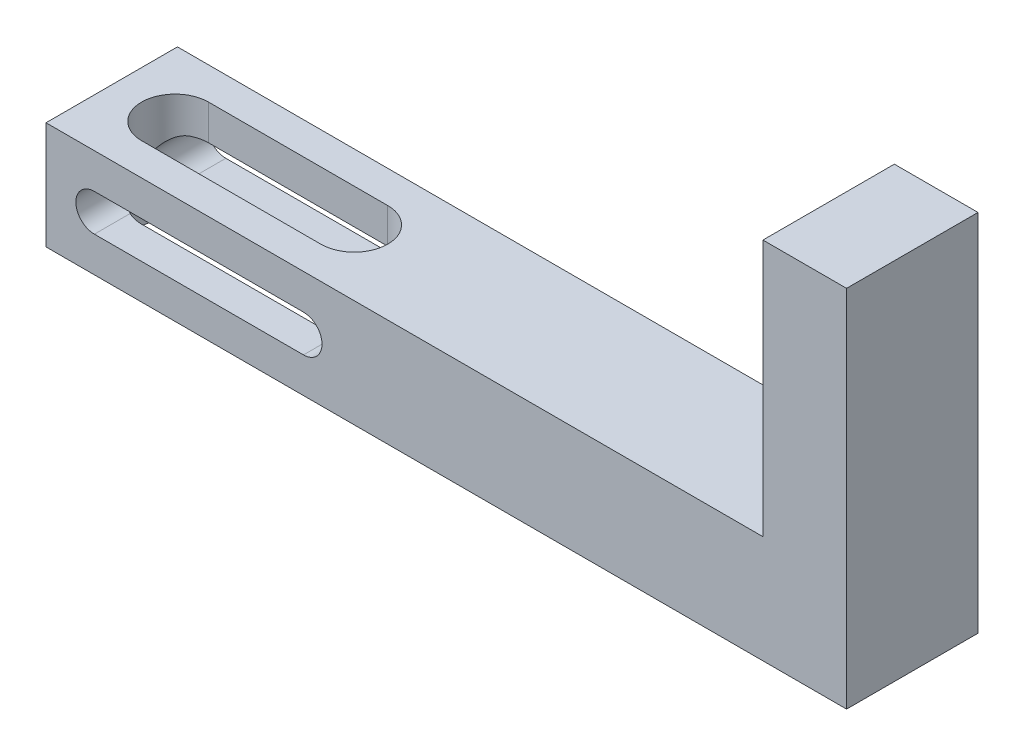
from build123d import *

# Parameters (mm, degrees)
BOSS_EXTRUDE1_DEPTH = 11
CUT_EXTRUDE1_DEPTH  = 75.432855649
CUT_EXTRUDE2_DEPTH  = 75.432855649


with BuildPart() as part:
    # Sketch1 → Boss-Extrude1 (new body)
    with BuildSketch(Plane.XY):
        Polygon((0, 0), (67, 0), (67, 30.5), (60, 30.5), (60, 9), (0, 9), align=None)
    extrude(amount=-BOSS_EXTRUDE1_DEPTH)

    # Sketch2 → Cut-Extrude1 (cut, through all)
    with BuildSketch(Plane.XZ):
        with BuildLine():
            Line((5.3, -2.7), (20.3, -2.7))
            ThreePointArc((20.3, -2.7), (23.1, -5.5), (20.3, -8.3))
            Line((20.3, -8.3), (5.3, -8.3))
            ThreePointArc((5.3, -8.3), (2.5, -5.5), (5.3, -2.7))
        make_face()
    extrude(amount=-CUT_EXTRUDE1_DEPTH, mode=Mode.SUBTRACT)

    # Sketch3 → Cut-Extrude2 (cut, through all)
    with BuildSketch(Plane.XY):
        with BuildLine():
            Line((4.05, 6.05), (21.55, 6.05))
            ThreePointArc((21.55, 6.05), (23.1, 4.5), (21.55, 2.95))
            Line((21.55, 2.95), (4.05, 2.95))
            ThreePointArc((4.05, 2.95), (2.5, 4.5), (4.05, 6.05))
        make_face()
    extrude(amount=-CUT_EXTRUDE2_DEPTH, mode=Mode.SUBTRACT)


solid = part.part
